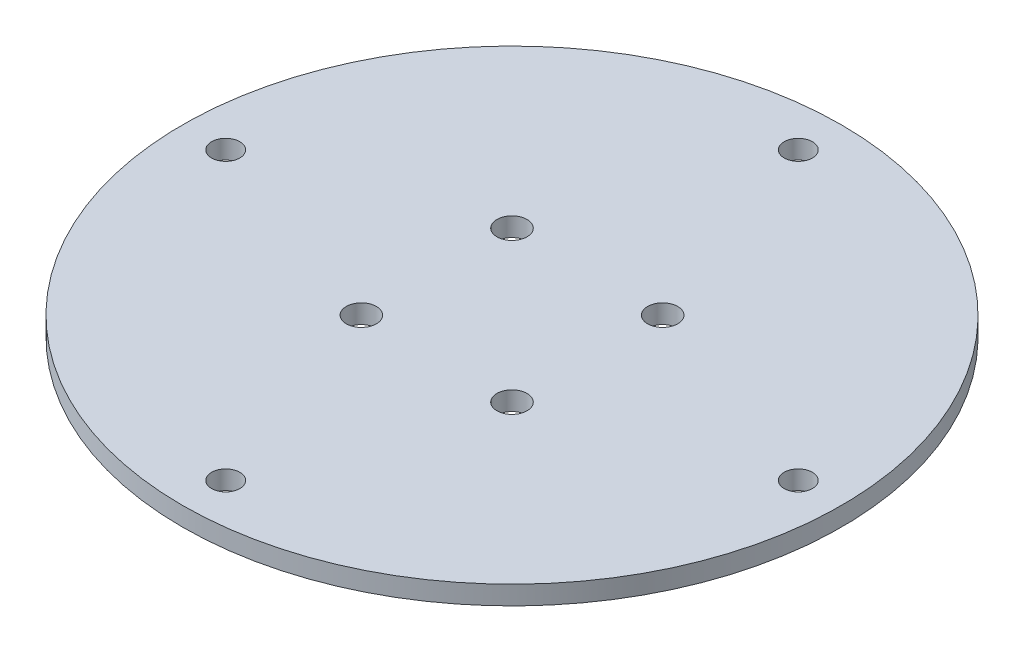
from build123d import *

# Parameters (mm, degrees)
SKETCH1_R           = 35
SKETCH1_R_2         = 1.5
SKETCH1_R_3         = 1.6
BOSS_EXTRUDE1_DEPTH = 2


with BuildPart() as part:
    # Sketch1 → Boss-Extrude1 (new body)
    with BuildSketch(Plane(origin=(0, 0, 0), x_dir=(1, 0, 0), z_dir=(0, 1, 0))):
        with Locations(Location((0, 0, 0), (0, 0, 270))):
            Circle(SKETCH1_R)
        with Locations(Location((0, 30.405591591, 0), (0, 0, 270))):
            Circle(SKETCH1_R_2, mode=Mode.SUBTRACT)
        with Locations(Location((30.405591591, 0, 0), (0, 0, 270))):
            Circle(SKETCH1_R_2, mode=Mode.SUBTRACT)
        with Locations(Location((0, -30.405591591, 0), (0, 0, 270))):
            Circle(SKETCH1_R_2, mode=Mode.SUBTRACT)
        with Locations(Location((-30.405591591, 0, 0), (0, 0, 270))):
            Circle(SKETCH1_R_2, mode=Mode.SUBTRACT)
        with Locations(Location((-8, 8, 0), (0, 0, 270))):
            Circle(SKETCH1_R_3, mode=Mode.SUBTRACT)
        with Locations(Location((8, 8, 0), (0, 0, 270))):
            Circle(SKETCH1_R_3, mode=Mode.SUBTRACT)
        with Locations(Location((8, -8, 0), (0, 0, 270))):
            Circle(SKETCH1_R_3, mode=Mode.SUBTRACT)
        with Locations(Location((-8, -8, 0), (0, 0, 270))):
            Circle(SKETCH1_R_3, mode=Mode.SUBTRACT)
    extrude(amount=BOSS_EXTRUDE1_DEPTH)


solid = part.part
